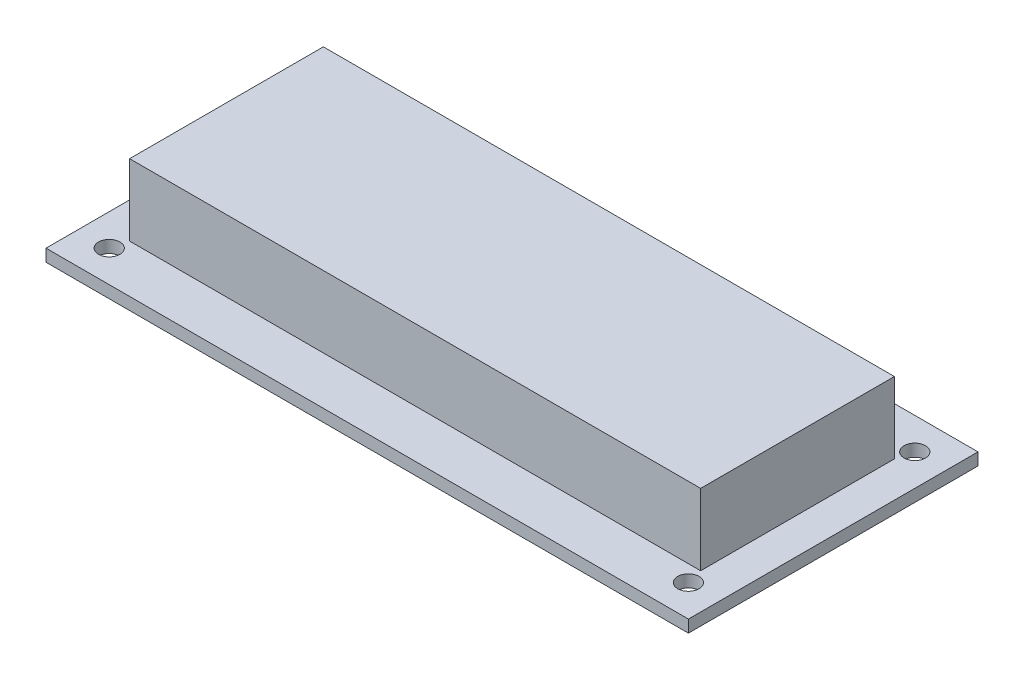
from build123d import *

# Parameters (mm, degrees)
SKETCH1_W           = 80.01
SKETCH1_H           = 36.068
BOSS_EXTRUDE1_DEPTH = 1.524
CUT_EXTRUDE1_REACH  = 45.908
SKETCH2_R           = 1.3335
SKETCH3_W           = 71.12
SKETCH3_H           = 24.13
BOSS_EXTRUDE2_DEPTH = 8.89
SKETCH4_W           = 2.921
SKETCH4_H           = 18.0848
BOSS_EXTRUDE3_DEPTH = 3.175


with BuildPart() as part:
    # Sketch1 → Boss-Extrude1 (new body)
    with BuildSketch(Plane(origin=(0, 0, 0), x_dir=(1, 0, 0), z_dir=(0, 1, 0))):
        Rectangle(SKETCH1_W, SKETCH1_H)
    extrude(amount=BOSS_EXTRUDE1_DEPTH)

    # Sketch2 → Cut-Extrude1 (cut, up to next)
    with BuildSketch(Plane(origin=(0, 1.524, 0), x_dir=(1, 0, 0), z_dir=(0, 1, 0)), mode=Mode.PRIVATE) as cut_extrude1_sk1:
        with Locations(Location((-36.068, 14.097, 0), (0, 0, 270))):
            Circle(SKETCH2_R)
    cut_extrude1_tool1 = extrude(cut_extrude1_sk1.sketch, amount=-CUT_EXTRUDE1_REACH, mode=Mode.PRIVATE) & part.part
    # Sketch2 → Cut-Extrude1 (cut, up to next)
    with BuildSketch(Plane(origin=(0, 1.524, 0), x_dir=(1, 0, 0), z_dir=(0, 1, 0)), mode=Mode.PRIVATE) as cut_extrude1_sk2:
        with Locations(Location((36.068, 14.097, 0), (0, 0, 270))):
            Circle(SKETCH2_R)
    cut_extrude1_tool2 = extrude(cut_extrude1_sk2.sketch, amount=-CUT_EXTRUDE1_REACH, mode=Mode.PRIVATE) & part.part
    # Sketch2 → Cut-Extrude1 (cut, up to next)
    with BuildSketch(Plane(origin=(0, 1.524, 0), x_dir=(1, 0, 0), z_dir=(0, 1, 0)), mode=Mode.PRIVATE) as cut_extrude1_sk3:
        with Locations(Location((36.068, -14.097, 0), (0, 0, 270))):
            Circle(SKETCH2_R)
    cut_extrude1_tool3 = extrude(cut_extrude1_sk3.sketch, amount=-CUT_EXTRUDE1_REACH, mode=Mode.PRIVATE) & part.part
    # Sketch2 → Cut-Extrude1 (cut, up to next)
    with BuildSketch(Plane(origin=(0, 1.524, 0), x_dir=(1, 0, 0), z_dir=(0, 1, 0)), mode=Mode.PRIVATE) as cut_extrude1_sk4:
        with Locations(Location((-36.068, -14.097, 0), (0, 0, 270))):
            Circle(SKETCH2_R)
    cut_extrude1_tool4 = extrude(cut_extrude1_sk4.sketch, amount=-CUT_EXTRUDE1_REACH, mode=Mode.PRIVATE) & part.part
    add(cut_extrude1_tool1.solids().sort_by_distance((-36.068, 1.524, -14.097))[0], mode=Mode.SUBTRACT)
    add(cut_extrude1_tool2.solids().sort_by_distance((36.068, 1.524, -14.097))[0], mode=Mode.SUBTRACT)
    add(cut_extrude1_tool3.solids().sort_by_distance((36.068, 1.524, 14.097))[0], mode=Mode.SUBTRACT)
    add(cut_extrude1_tool4.solids().sort_by_distance((-36.068, 1.524, 14.097))[0], mode=Mode.SUBTRACT)

    # Sketch3 → Boss-Extrude2 (add)
    with BuildSketch(Plane(origin=(0, 1.524, 0), x_dir=(1, 0, 0), z_dir=(0, 1, 0))):
        Rectangle(SKETCH3_W, SKETCH3_H)
    extrude(amount=BOSS_EXTRUDE2_DEPTH)

    # Sketch4 → Boss-Extrude3 (add)
    with BuildSketch(Plane(origin=(0, 1.524, 0), x_dir=(1, 0, 0), z_dir=(0, 1, 0))):
        with Locations((-37.0205, 0.0254)):
            Rectangle(SKETCH4_W, SKETCH4_H)
    extrude(amount=BOSS_EXTRUDE3_DEPTH)


solid = part.part
